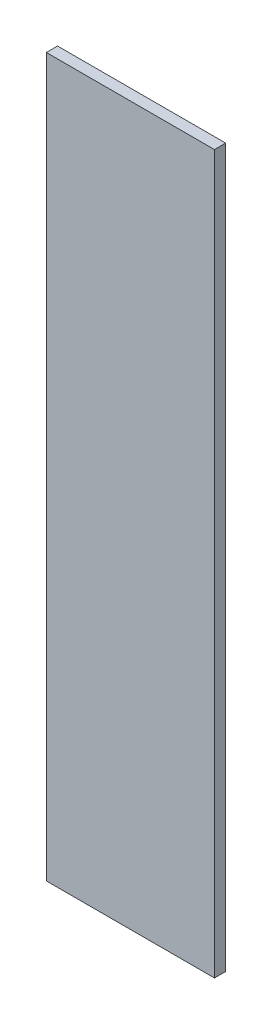
from build123d import *

# Parameters (mm, degrees)
SKETCH1_W           = 15
SKETCH1_H           = 64
BOSS_EXTRUDE1_DEPTH = 1


with BuildPart() as part:
    # Sketch1 → Boss-Extrude1 (new body)
    with BuildSketch(Plane.XY):
        with Locations((-22, 0)):
            Rectangle(SKETCH1_W, SKETCH1_H)
    extrude(amount=-BOSS_EXTRUDE1_DEPTH)


solid = part.part
